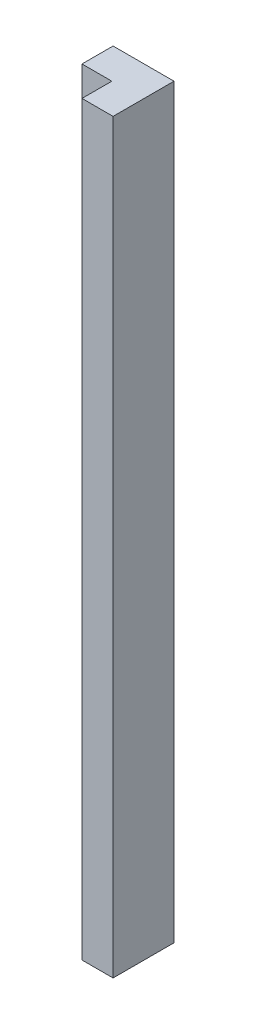
from build123d import *

# Parameters (mm, degrees)
SKETCH1_W           = 9.8
SKETCH1_H           = 120
BOSS_EXTRUDE1_DEPTH = 5
SKETCH2_W           = 5
SKETCH2_H           = 120
BOSS_EXTRUDE2_DEPTH = 4.8


with BuildPart() as part:
    # Sketch1 → Boss-Extrude1 (new body)
    with BuildSketch(Plane.XY):
        with Locations((4.9, 60)):
            Rectangle(SKETCH1_W, SKETCH1_H)
    extrude(amount=BOSS_EXTRUDE1_DEPTH)

    # Sketch2 → Boss-Extrude2 (add)
    with BuildSketch(Plane.XY.offset(5)):
        with Locations((7.3, 60)):
            Rectangle(SKETCH2_W, SKETCH2_H)
    extrude(amount=BOSS_EXTRUDE2_DEPTH)


solid = part.part
